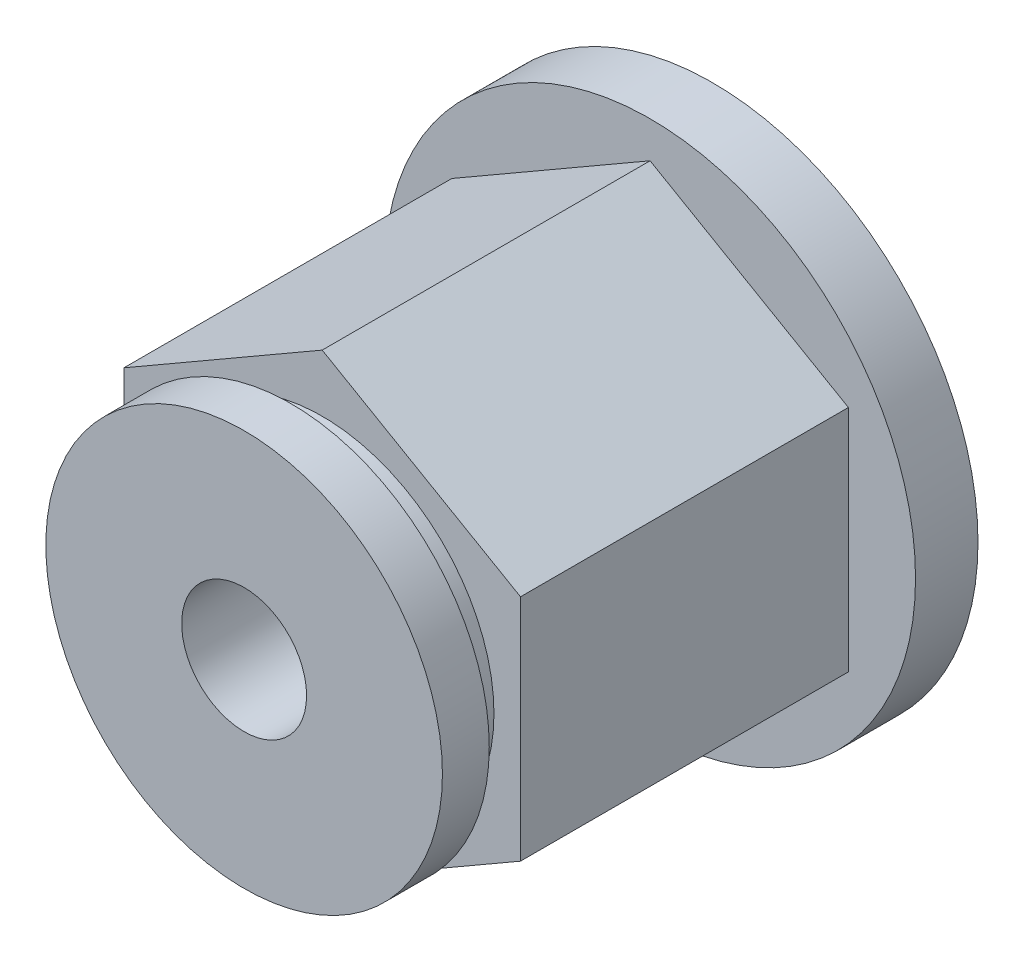
from build123d import *

# Parameters (mm, degrees)
ESQUISSE1_R             = 8.5
BOSS_EXTRU_1_DEPTH      = 2
BOSS_EXTRU_2_DEPTH      = 10.5
ESQUISSE3_R             = 5.5
BOSS_EXTRU_3_DEPTH      = 1
ESQUISSE4_R             = 6.35
BOSS_EXTRU_4_DEPTH      = 1.5
ESQUISSE5_R             = 2
ENL_V_MAT_EXTRU_1_DEPTH = 20.222382787


with BuildPart() as part:
    # Esquisse1 → Boss.-Extru.1 (new body)
    with BuildSketch(Plane.XY):
        Circle(ESQUISSE1_R)
    extrude(amount=BOSS_EXTRU_1_DEPTH)

    # Esquisse2 → Boss.-Extru.2 (add)
    with BuildSketch(Plane.XY.offset(2)):
        Polygon((6.35, -3.666174209), (6.35, 3.666174209), (0, 7.332348419), (-6.35, 3.666174209), (-6.35, -3.666174209), (0, -7.332348419), align=None)
    extrude(amount=BOSS_EXTRU_2_DEPTH)

    # Esquisse3 → Boss.-Extru.3 (add)
    with BuildSketch(Plane.XY.offset(12.5)):
        Circle(ESQUISSE3_R)
    extrude(amount=BOSS_EXTRU_3_DEPTH)

    # Esquisse4 → Boss.-Extru.4 (add)
    with BuildSketch(Plane.XY.offset(13.5)):
        Circle(ESQUISSE4_R)
    extrude(amount=BOSS_EXTRU_4_DEPTH)

    # Esquisse5 → Enlèv. mat.-Extru.1 (cut, through all)
    with BuildSketch(Plane.XY.offset(15)):
        Circle(ESQUISSE5_R)
    extrude(amount=-ENL_V_MAT_EXTRU_1_DEPTH, mode=Mode.SUBTRACT)


solid = part.part
